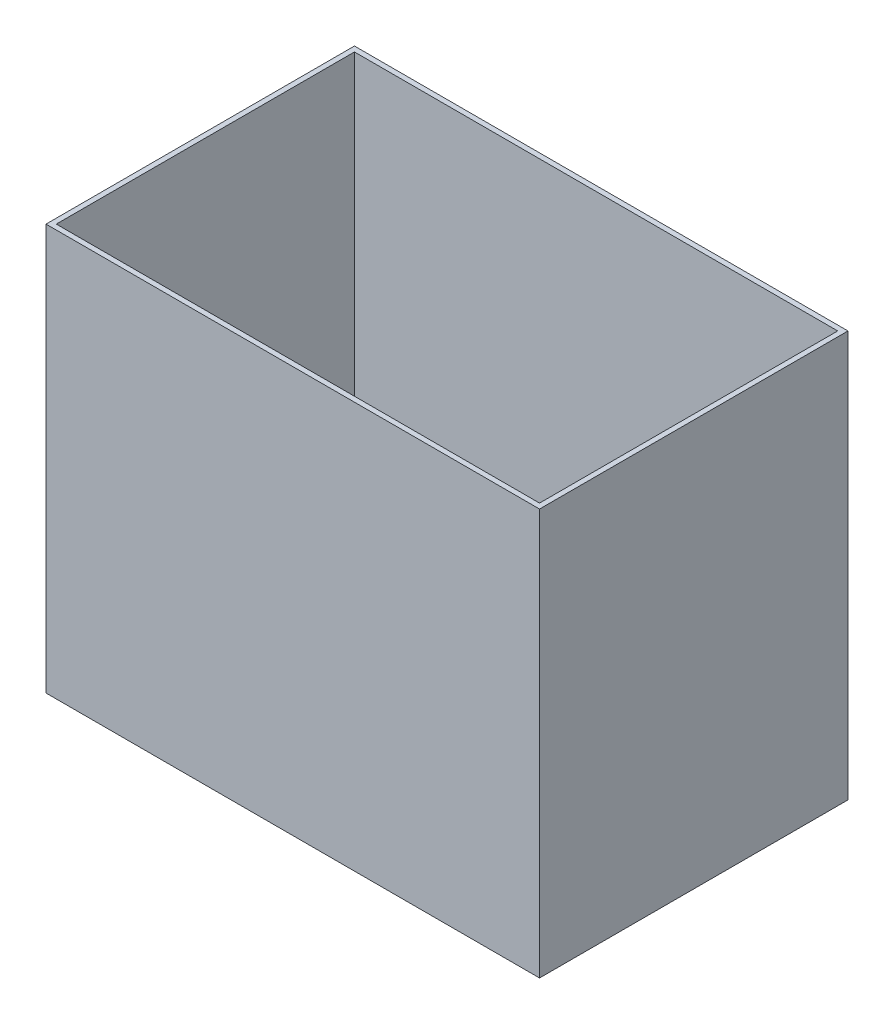
from build123d import *

# Parameters (mm, degrees)
SKETCH1_W           = 480
SKETCH1_H           = 300
BOSS_EXTRUDE2_DEPTH = 5
SKETCH2_W           = 480
SKETCH2_H           = 300
SKETCH2_W_2         = 470
SKETCH2_H_2         = 290
BOSS_EXTRUDE3_DEPTH = 390


with BuildPart() as part:
    # Sketch1 → Boss-Extrude2 (new body)
    with BuildSketch(Plane(origin=(0, 0, 0), x_dir=(1, 0, 0), z_dir=(0, 1, 0))):
        with Locations((240, -150)):
            Rectangle(SKETCH1_W, SKETCH1_H)
    extrude(amount=BOSS_EXTRUDE2_DEPTH)

    # Sketch2 → Boss-Extrude3 (add)
    with BuildSketch(Plane(origin=(0, 5, 0), x_dir=(1, 0, 0), z_dir=(0, 1, 0))):
        with Locations((240, -150)):
            Rectangle(SKETCH2_W, SKETCH2_H)
        with Locations((240, -150)):
            Rectangle(SKETCH2_W_2, SKETCH2_H_2, mode=Mode.SUBTRACT)
    extrude(amount=BOSS_EXTRUDE3_DEPTH)


solid = part.part
